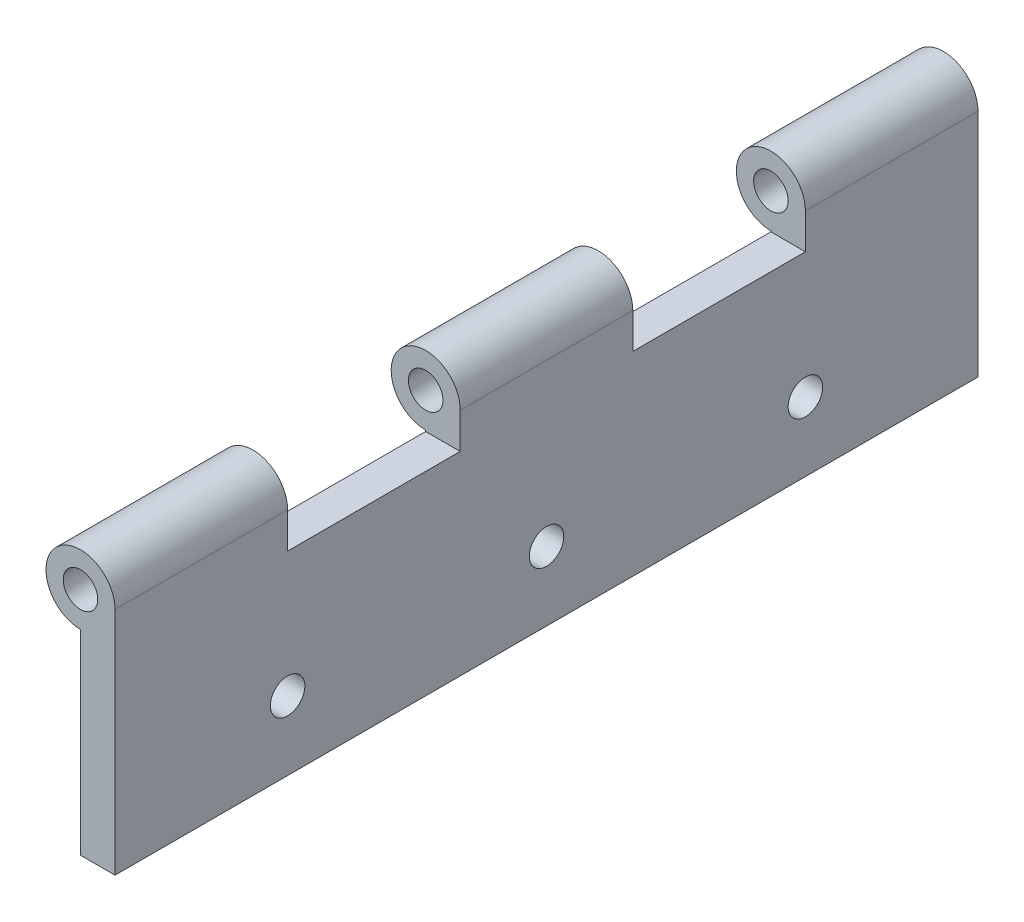
from build123d import *

# Parameters (mm, degrees)
BOSS_EXTRUDE1_DEPTH      = 37.5
BOSS_EXTRUDE1_DEPTH_BACK = 37.5
SKETCH2_R                = 1.5
CUT_EXTRUDE3_DEPTH       = 10
CUT_EXTRUDE3_DEPTH_BACK  = 10
SKETCH4_R                = 1.5
SKETCH4_W                = 15
SKETCH4_H                = 10


with BuildPart() as part:
    # Sketch2 → Boss-Extrude1 (new, two sides: drawn at the far end of the back side and taken through both)
    with BuildSketch(Plane.XY.offset(-BOSS_EXTRUDE1_DEPTH_BACK)):
        with BuildLine():
            Line((-2.046544696, -13.643631305), (-2.046544696, 3.356368695))
            ThreePointArc((-2.046544696, 3.356368695), (-4.167865039, 8.477689038), (0.953455304, 6.356368695))
            Line((0.953455304, 6.356368695), (0.953455304, -13.643631305))
            Line((0.953455304, -13.643631305), (-2.046544696, -13.643631305))
        make_face()
        with Locations((-2.046544696, 6.356368695)):
            Circle(SKETCH2_R, mode=Mode.SUBTRACT)
    extrude(amount=BOSS_EXTRUDE1_DEPTH + BOSS_EXTRUDE1_DEPTH_BACK)

    # Sketch4 → Cut-Extrude3 (cut, two sides: drawn at the far end of the back side and taken through both)
    with BuildSketch(Plane.ZY.offset(2.046544696).offset(-CUT_EXTRUDE3_DEPTH_BACK)):
        with Locations((-22.5, -7.643631305)):
            Circle(SKETCH4_R)
        with Locations((0, -7.643631305)):
            Circle(SKETCH4_R)
        with Locations((22.5, -7.643631305)):
            Circle(SKETCH4_R)
        with Locations((-15, 8.277390495)):
            Rectangle(SKETCH4_W, SKETCH4_H)
        with Locations((15, 8.251)):
            Rectangle(SKETCH4_W, SKETCH4_H)
    extrude(amount=CUT_EXTRUDE3_DEPTH + CUT_EXTRUDE3_DEPTH_BACK, mode=Mode.SUBTRACT)


solid = part.part
